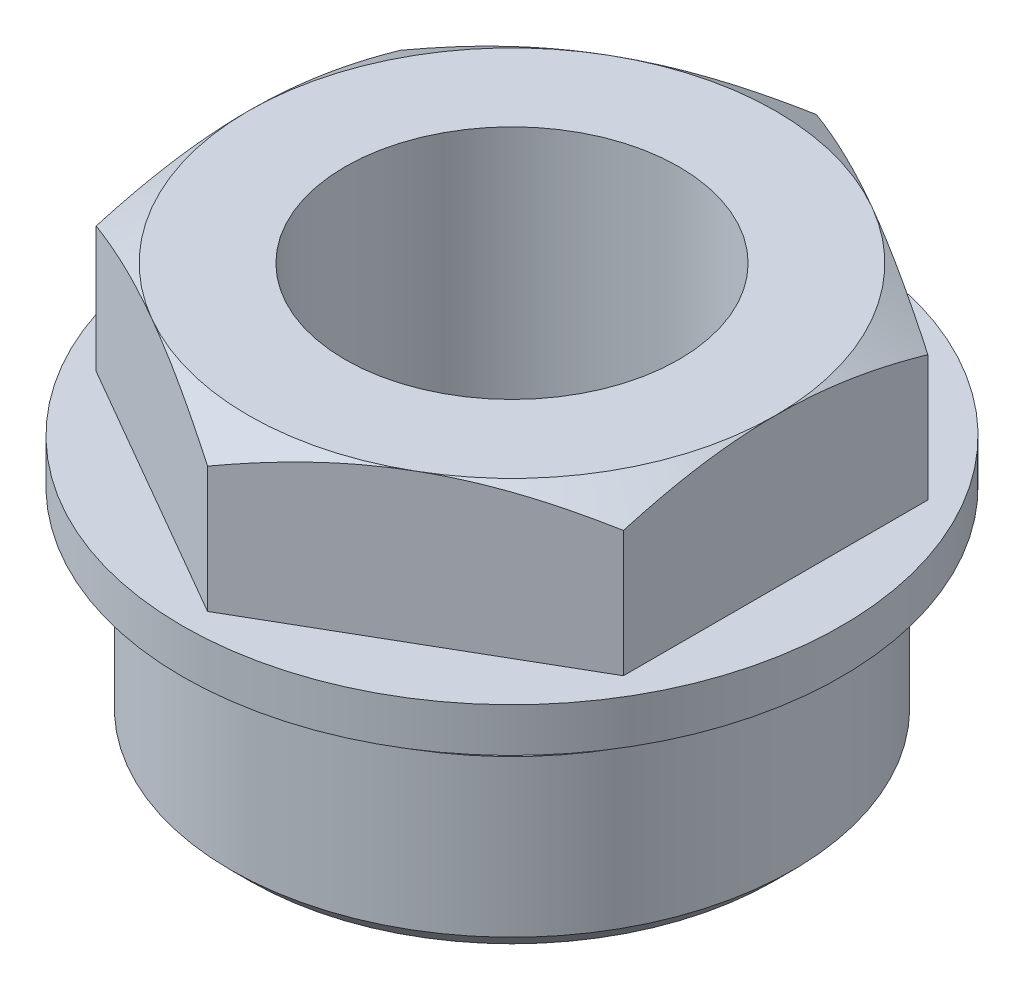
from build123d import *

# Parameters (mm, degrees)
CHAMFER_1_SIZE      = 2.195
SKETCH_2_R          = 37.5
CUT_EXTRUDE_1_DEPTH = 61.444189133
SKETCH_3_R          = 25
EXTRUDE_1_DEPTH     = 17


with BuildPart() as part:
    # Эскиз1 → Повернуть1 (revolve)
    with BuildSketch(Plane.XY, mode=Mode.PRIVATE) as revolve_1_sk:
        Polygon((25, 0), (32, 0), (32, 20), (28, 20), (28, 24), (37.5, 24), (37.5, 29), (32.5, 29), (32.5, 42.535898385), (26.5, 46), (19, 46), (19, 5), (25, 5), align=None)
    revolve(revolve_1_sk.sketch.rotate(Axis((0, 57.260780425, 0), (0, -1, 0)), 90), axis=Axis((0, 57.260780425, 0), (0, -1, 0)))

    # Фаска1
    chamfer_1_edges = [part.edges().sort_by_distance(p)[0] for p in [
        (0, 0, -32),
    ]]
    chamfer(chamfer_1_edges, length=CHAMFER_1_SIZE)

    # Эскиз2 → Вырез-Вытянуть1 (cut, through all)
    with BuildSketch(Plane(origin=(0, 29, 0), x_dir=(1, 0, 0), z_dir=(0, 1, 0))):
        with Locations(Location((0, 0, 0), (0, 0, 270))):
            Circle(SKETCH_2_R)
        Polygon((0, 34.641016151), (-30, 17.320508076), (-30, -17.320508076), (0, -34.641016151), (30, -17.320508076), (30, 17.320508076), align=None, mode=Mode.SUBTRACT)
    extrude(amount=CUT_EXTRUDE_1_DEPTH, mode=Mode.SUBTRACT)

    # Эскиз3 → Бобышка-Вытянуть1 (add)
    with BuildSketch(Plane(origin=(0, 29, 0), x_dir=(1, 0, 0), z_dir=(0, 1, 0))):
        Polygon((0, 34.641016151), (-30, 17.320508076), (-30, -17.320508076), (0, -34.641016151), (30, -17.320508076), (30, 17.320508076), align=None)
        with Locations(Location((0, 0, 0), (0, 0, 270))):
            Circle(SKETCH_3_R, mode=Mode.SUBTRACT)
    extrude(amount=EXTRUDE_1_DEPTH)

    # Эскиз4 → Вырез-Повернуть1 (revolve, cut)
    with BuildSketch(Plane.XY):
        Polygon((-30, 46), (-45, 46), (-45, 37.339745962), align=None)
    revolve(axis=Axis((0, 0, 0), (0, 1, 0)), mode=Mode.SUBTRACT)


solid = part.part
